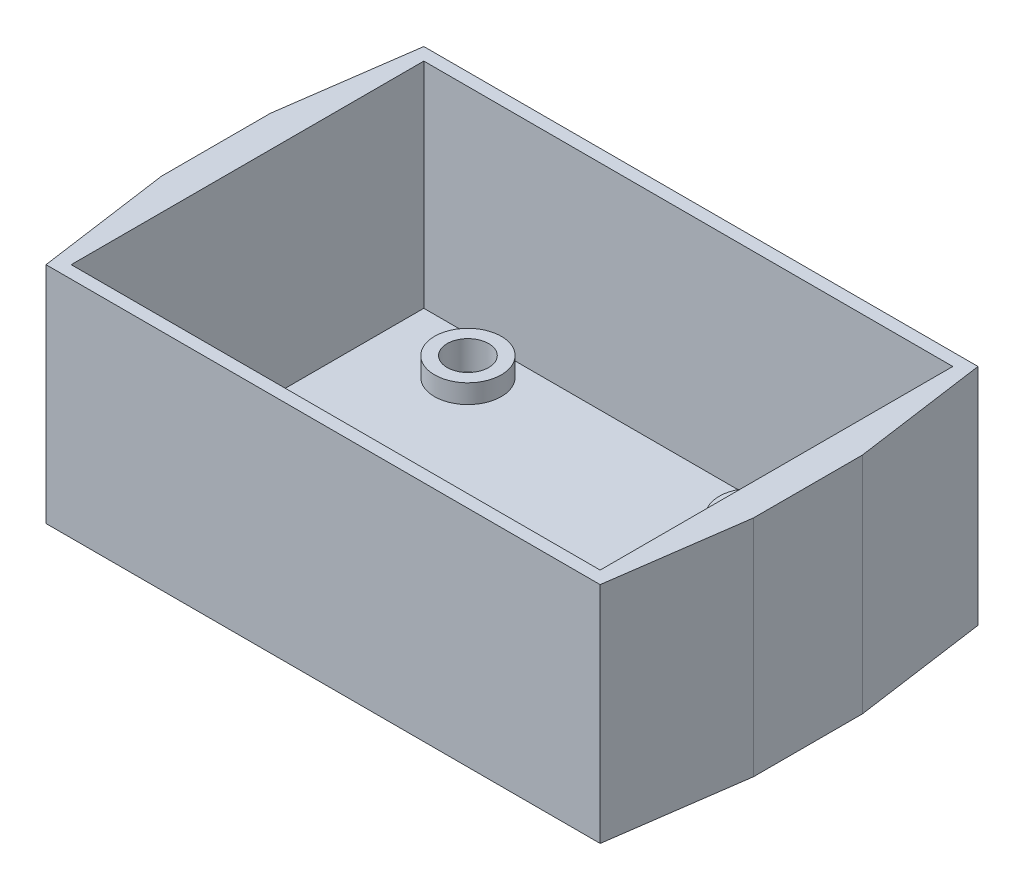
from build123d import *

# Parameters (mm, degrees)
SKETCH1_W           = 42
SKETCH1_H           = 28
BOSS_EXTRUDE1_DEPTH = 17
BOSS_EXTRUDE3_DEPTH = 0.8
SKETCH4_R           = 1.65
CUT_EXTRUDE1_DEPTH  = 10.8
SKETCH5_W           = 10
SKETCH5_H           = 5
CUT_EXTRUDE2_DEPTH  = 10.8
FILLET1_R           = 1.5
BOSS_EXTRUDE4_START = 1.5
SKETCH6_R           = 2.65
SKETCH6_R_2         = 1.65
BOSS_EXTRUDE4_DEPTH = 1.5


with BuildPart() as part:
    # Sketch1 → Boss-Extrude1 (new body)
    with BuildSketch(Plane(origin=(0, 0, 0), x_dir=(1, 0, 0), z_dir=(0, 1, 0))):
        Polygon((-22, 15), (-23.5, 4.326945416), (-23.5, -4.326945416), (-22, -15), (22, -15), (23.5, -4.326945416), (23.5, 4.326945416), (22, 15), align=None)
        Rectangle(SKETCH1_W, SKETCH1_H, mode=Mode.SUBTRACT)
    extrude(amount=BOSS_EXTRUDE1_DEPTH)

    # Sketch3 → Boss-Extrude3 (add)
    with BuildSketch(Plane.XZ):
        Polygon((-22, 15), (22, 15), (23.5, 4.326945416), (23.5, -4.326945416), (22, -15), (-22, -15), (-23.5, -4.326945416), (-23.5, 4.326945416), align=None)
    extrude(amount=BOSS_EXTRUDE3_DEPTH)

    # Sketch4 → Cut-Extrude1 (cut)
    with BuildSketch(Plane(origin=(0, 0, 0), x_dir=(1, 0, 0), z_dir=(0, 1, 0))):
        with Locations(Location((-14.5, 11, 0), (0, 0, 270))):
            Circle(SKETCH4_R)
        with Locations(Location((7.8, 11.302833977, 0), (0, 0, 270))):
            Circle(SKETCH4_R)
        with Locations(Location((-14.5, -11, 0), (0, 0, 270))):
            Circle(SKETCH4_R)
        with Locations(Location((7.8, -11.16509614, 0), (0, 0, 270))):
            Circle(SKETCH4_R)
    extrude(amount=-CUT_EXTRUDE1_DEPTH, mode=Mode.SUBTRACT)

    # Sketch5 → Cut-Extrude2 (cut)
    with BuildSketch(Plane.XY.offset(-14)):
        with Locations((16, 4)):
            Rectangle(SKETCH5_W, SKETCH5_H)
    extrude(amount=-CUT_EXTRUDE2_DEPTH, mode=Mode.SUBTRACT)

    # Fillet1
    fillet1_edges = [part.edges().sort_by_distance(p)[0] for p in [
        (11, 1.5, -14.5),
        (11, 6.5, -14.5),
    ]]
    fillet(fillet1_edges, radius=FILLET1_R)

    # Sketch6 → Boss-Extrude4 (add)
    # profile 1 of 4: a face of its own
    with BuildSketch(Plane(origin=(0, 0, 0), x_dir=(1, 0, 0), z_dir=(0, 1, 0)).offset(BOSS_EXTRUDE4_START)):
        with Locations(Location((-14.5, 11, 0), (0, 0, 270))):
            Circle(SKETCH6_R)
        with Locations(Location((-14.5, 11, 0), (0, 0, 270))):
            Circle(SKETCH6_R_2, mode=Mode.SUBTRACT)
    # profile 2 of 4: a face of its own
    with BuildSketch(Plane(origin=(0, 0, 0), x_dir=(1, 0, 0), z_dir=(0, 1, 0)).offset(BOSS_EXTRUDE4_START)):
        with Locations(Location((7.8, 11.302833977, 0), (0, 0, 270))):
            Circle(SKETCH6_R)
        with Locations(Location((7.8, 11.302833977, 0), (0, 0, 270))):
            Circle(SKETCH6_R_2, mode=Mode.SUBTRACT)
    # profile 3 of 4: a face of its own
    with BuildSketch(Plane(origin=(0, 0, 0), x_dir=(1, 0, 0), z_dir=(0, 1, 0)).offset(BOSS_EXTRUDE4_START)):
        with Locations(Location((7.8, -11.16509614, 0), (0, 0, 270))):
            Circle(SKETCH6_R)
        with Locations(Location((7.8, -11.16509614, 0), (0, 0, 270))):
            Circle(SKETCH6_R_2, mode=Mode.SUBTRACT)
    # profile 4 of 4: a face of its own
    with BuildSketch(Plane(origin=(0, 0, 0), x_dir=(1, 0, 0), z_dir=(0, 1, 0)).offset(BOSS_EXTRUDE4_START)):
        with Locations(Location((-14.5, -11, 0), (0, 0, 270))):
            Circle(SKETCH6_R)
        with Locations(Location((-14.5, -11, 0), (0, 0, 270))):
            Circle(SKETCH6_R_2, mode=Mode.SUBTRACT)
    extrude(amount=-BOSS_EXTRUDE4_DEPTH)


solid = part.part
